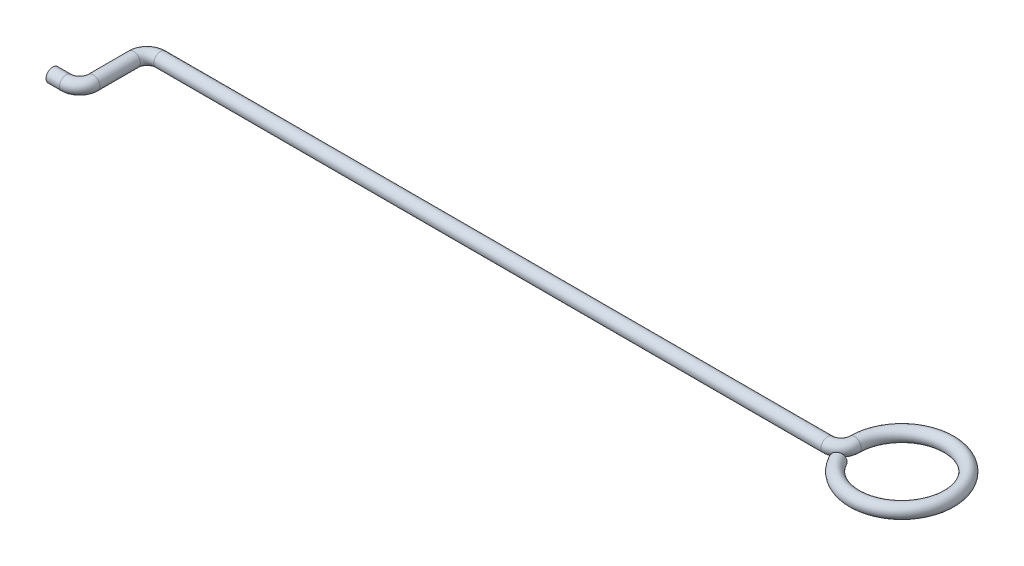
from build123d import *

# Parameters (mm, degrees)
SKETCH2_R = 0.5


with BuildPart() as part:
    # Sweep1: sweep along a path in Sketch1
    with BuildLine(Plane(origin=(0, 0, 0), x_dir=(1, 0, 0), z_dir=(0, 1, 0))) as sweep1_path:
        Line((0, 0), (1, 0))
        ThreePointArc((1, 0), (1.707106781, 0.292893219), (2, 1))
        Line((2, 1), (2, 4))
        ThreePointArc((2, 4), (2.292893219, 4.707106781), (3, 5))
        Line((3, 5), (52.5, 5))
        ThreePointArc((52.5, 5), (53.207106781, 5.292893219), (53.5, 6))
        ThreePointArc((53.5, 6), (60.397162622, 6.842191259), (53.905306352, 4.365108191))
    # Sketch2 → Sweep1 (sweep)
    with BuildSketch(Plane(origin=(0, 0, 0), x_dir=(0, 0, -1), z_dir=(1, 0, 0))):
        Circle(SKETCH2_R)
    sweep(path=sweep1_path.line)


solid = part.part
